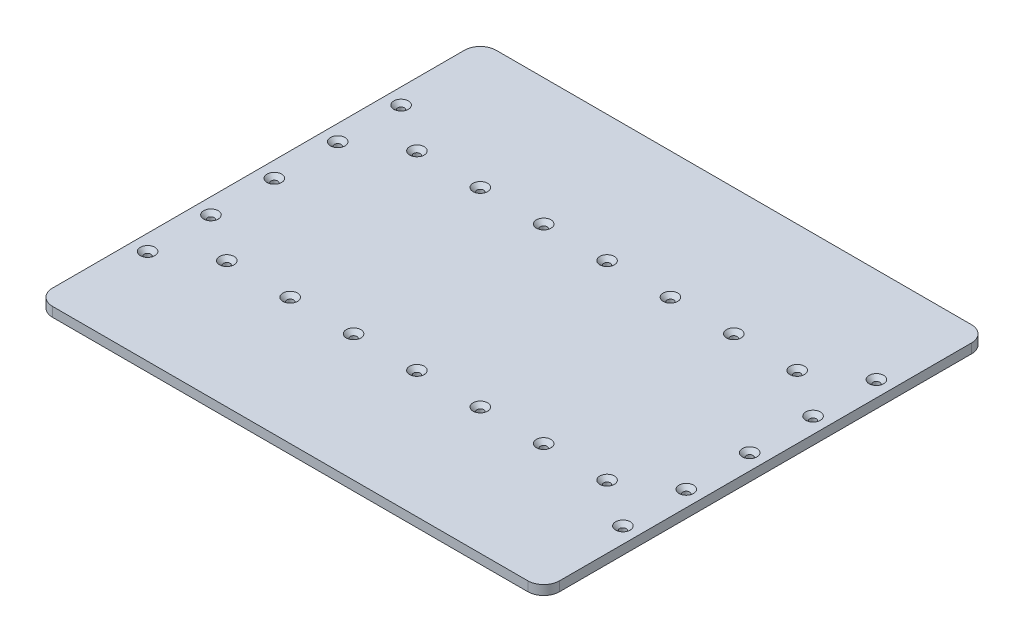
from build123d import *

# Parameters (mm, degrees)
EXTRUDE_1_DEPTH     = 3
SKETCH_5_R          = 2.1
CUT_EXTRUDE_4_DEPTH = 240
CHAMFER_2_SIZE      = 2.5


with BuildPart() as part:
    # 草图1 → 凸台-拉伸1 (new, symmetric)
    with BuildSketch(Plane(origin=(0, 0, 0), x_dir=(1, 0, 0), z_dir=(0, 1, 0))):
        with BuildLine():
            Line((-150, -140), (150, -140))
            ThreePointArc((150, -140), (157.071067812, -137.071067812), (160, -130))
            Line((160, -130), (160, 130))
            ThreePointArc((160, 130), (157.071067812, 137.071067812), (150, 140))
            Line((150, 140), (-150, 140))
            ThreePointArc((-150, 140), (-157.071067812, 137.071067812), (-160, 130))
            Line((-160, 130), (-160, -130))
            ThreePointArc((-160, -130), (-157.071067812, -137.071067812), (-150, -140))
        make_face()
    extrude(amount=EXTRUDE_1_DEPTH, both=True)

    # 草图5 → 切除-拉伸4 (cut)
    with BuildSketch(Plane(origin=(0, 3, 0), x_dir=(1, 0, 0), z_dir=(0, 1, 0))):
        with Locations(Location((0, 60, 0), (0, 0, 270))):
            Circle(SKETCH_5_R)
        with Locations(Location((40, 60, 0), (0, 0, 270))):
            Circle(SKETCH_5_R)
        with Locations(Location((80, 60, 0), (0, 0, 270))):
            Circle(SKETCH_5_R)
        with Locations(Location((120, 60, 0), (0, 0, 270))):
            Circle(SKETCH_5_R)
        with Locations(Location((-120, 60, 0), (0, 0, 270))):
            Circle(SKETCH_5_R)
        with Locations(Location((-80, 60, 0), (0, 0, 270))):
            Circle(SKETCH_5_R)
        with Locations(Location((-40, 60, 0), (0, 0, 270))):
            Circle(SKETCH_5_R)
        with Locations(Location((-40, -60, 0), (0, 0, 270))):
            Circle(SKETCH_5_R)
        with Locations(Location((-80, -60, 0), (0, 0, 270))):
            Circle(SKETCH_5_R)
        with Locations(Location((-120, -60, 0), (0, 0, 270))):
            Circle(SKETCH_5_R)
        with Locations(Location((120, -60, 0), (0, 0, 270))):
            Circle(SKETCH_5_R)
        with Locations(Location((80, -60, 0), (0, 0, 270))):
            Circle(SKETCH_5_R)
        with Locations(Location((40, -60, 0), (0, 0, 270))):
            Circle(SKETCH_5_R)
        with Locations(Location((0, -60, 0), (0, 0, 270))):
            Circle(SKETCH_5_R)
        with Locations(Location((-150, 0, 0), (0, 0, 270))):
            Circle(SKETCH_5_R)
        with Locations(Location((-150, -40, 0), (0, 0, 270))):
            Circle(SKETCH_5_R)
        with Locations(Location((-150, -80, 0), (0, 0, 270))):
            Circle(SKETCH_5_R)
        with Locations(Location((-150, 80, 0), (0, 0, 270))):
            Circle(SKETCH_5_R)
        with Locations(Location((-150, 40, 0), (0, 0, 270))):
            Circle(SKETCH_5_R)
        with Locations(Location((150, 40, 0), (0, 0, 270))):
            Circle(SKETCH_5_R)
        with Locations(Location((150, 80, 0), (0, 0, 270))):
            Circle(SKETCH_5_R)
        with Locations(Location((150, -80, 0), (0, 0, 270))):
            Circle(SKETCH_5_R)
        with Locations(Location((150, -40, 0), (0, 0, 270))):
            Circle(SKETCH_5_R)
        with Locations(Location((150, 0, 0), (0, 0, 270))):
            Circle(SKETCH_5_R)
    extrude(amount=-CUT_EXTRUDE_4_DEPTH, mode=Mode.SUBTRACT)

    # 倒角2
    chamfer_2_edges = [part.edges().sort_by_distance(p)[0] for p in [
        (-80, 3, -62.1),
        (-40, 3, -62.1),
        (-40, 3, 57.9),
        (-150, 3, -82.1),
        (-150, 3, -42.1),
        (150, 3, -42.1),
        (150, 3, -82.1),
        (150, 3, 77.9),
        (150, 3, 37.9),
        (150, 3, -2.1),
        (0, 3, -62.1),
        (-80, 3, 57.9),
        (-120, 3, 57.9),
        (120, 3, 57.9),
        (80, 3, 57.9),
        (40, 3, 57.9),
        (0, 3, 57.9),
        (-150, 3, 37.9),
        (-150, 3, 77.9),
        (-150, 3, -2.1),
        (120, 3, -62.1),
        (80, 3, -62.1),
        (40, 3, -62.1),
        (-120, 3, -62.1),
    ]]
    chamfer(chamfer_2_edges, length=CHAMFER_2_SIZE)


solid = part.part
